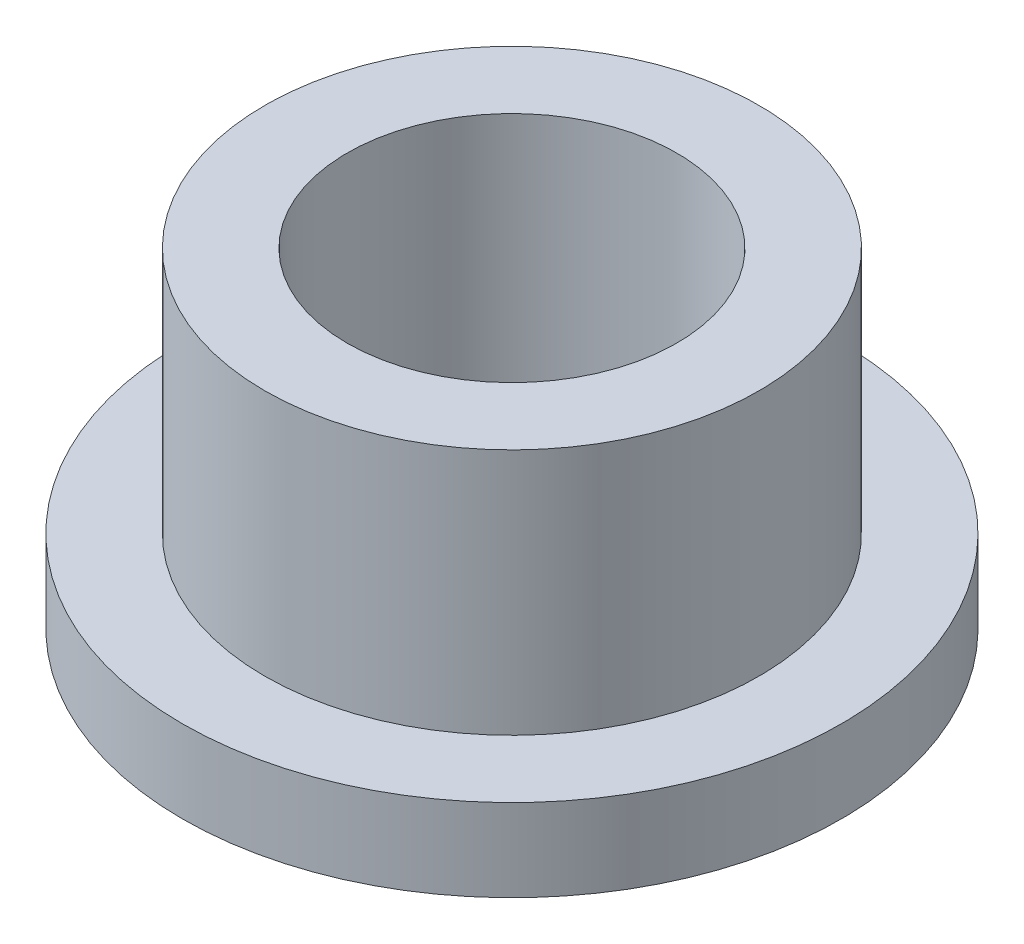
from build123d import *

# Parameters (mm, degrees)
SKETCH1_R           = 12.7
BOSS_EXTRUDE1_DEPTH = 3.175
SKETCH2_R           = 9.525
BOSS_EXTRUDE2_DEPTH = 9.525
SKETCH3_R           = 6.35
CUT_EXTRUDE1_DEPTH  = 22.997045256


with BuildPart() as part:
    # Sketch1 → Boss-Extrude1 (new body)
    with BuildSketch(Plane(origin=(0, 0, 0), x_dir=(1, 0, 0), z_dir=(0, 1, 0))):
        with Locations(Location((0, 0, 0), (0, 0, 270))):
            Circle(SKETCH1_R)
    extrude(amount=BOSS_EXTRUDE1_DEPTH)

    # Sketch2 → Boss-Extrude2 (add)
    with BuildSketch(Plane(origin=(0, 3.175, 0), x_dir=(1, 0, 0), z_dir=(0, 1, 0))):
        with Locations(Location((0, 0, 0), (0, 0, 270))):
            Circle(SKETCH2_R)
    extrude(amount=BOSS_EXTRUDE2_DEPTH)

    # Sketch3 → Cut-Extrude1 (cut, through all)
    with BuildSketch(Plane(origin=(0, 12.7, 0), x_dir=(1, 0, 0), z_dir=(0, 1, 0))):
        with Locations(Location((0, 0, 0), (0, 0, 270))):
            Circle(SKETCH3_R)
    extrude(amount=-CUT_EXTRUDE1_DEPTH, mode=Mode.SUBTRACT)


solid = part.part
